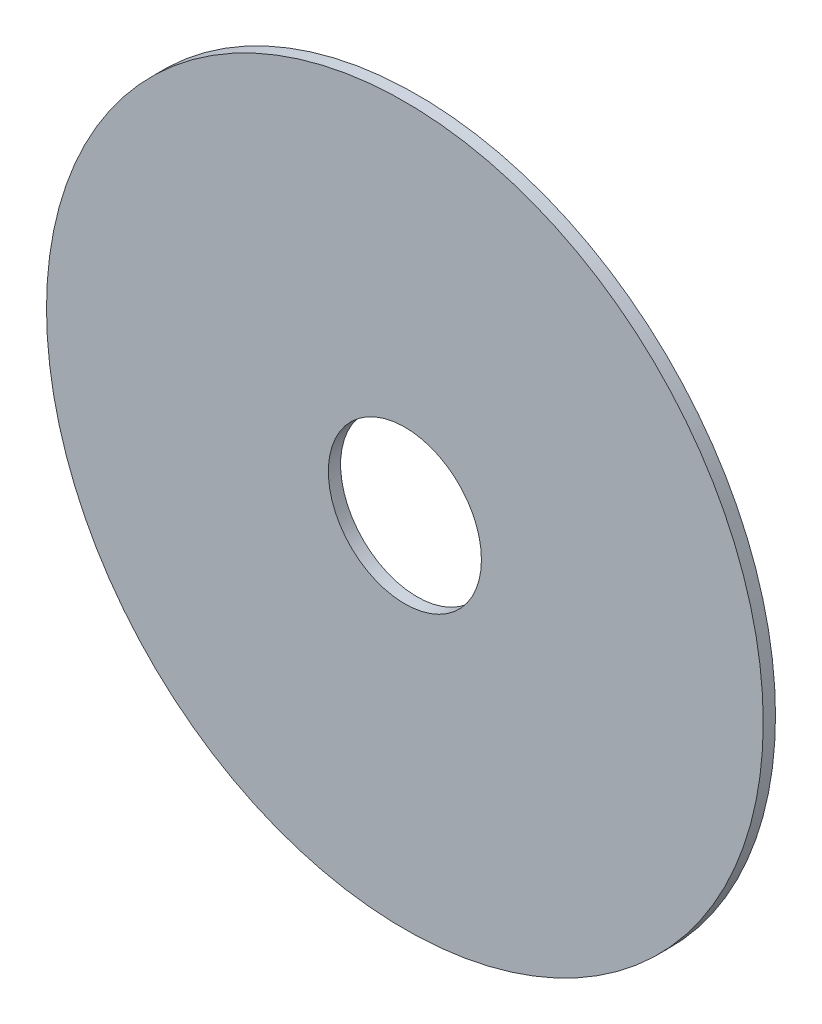
from build123d import *

# Parameters (mm, degrees)
SKETCH1_R           = 66.8909
SKETCH1_R_2         = 14.2875
BOSS_EXTRUDE1_DEPTH = 2.286


with BuildPart() as part:
    # Sketch1 → Boss-Extrude1 (new body)
    with BuildSketch(Plane.XY):
        Circle(SKETCH1_R)
        Circle(SKETCH1_R_2, mode=Mode.SUBTRACT)
    extrude(amount=BOSS_EXTRUDE1_DEPTH)


solid = part.part
